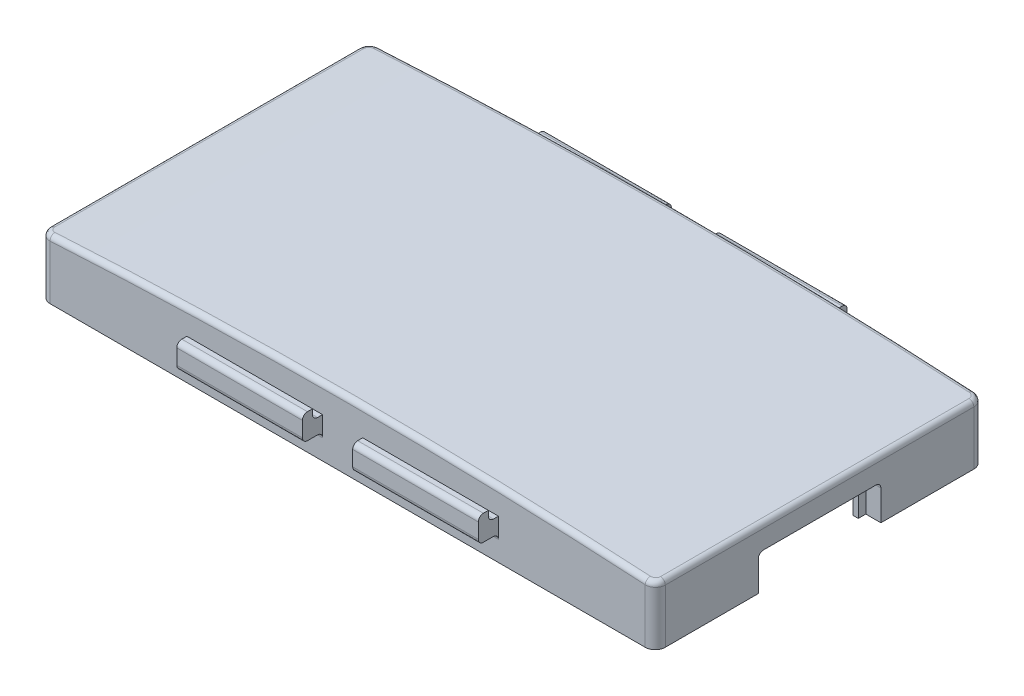
from build123d import *

# Parameters (mm, degrees)
BOSS_EXTRUDE4_DEPTH             = 0.5
BOSS_EXTRUDE5_REACH             = 36.87
BOSS_EXTRUDE5_DIRECTION_2_REACH = 36.87
BOSS_EXTRUDE6_REACH             = 37.345
BOSS_EXTRUDE6_END_RADIUS        = 508.215
SKETCH2_7_R                     = 1.125
FILLET3_R                       = 1
SKETCH6_W                       = 10.7
SKETCH6_H                       = 2.75
CUT_EXTRUDE2_DEPTH              = 2
SKETCH6_3_W                     = 10.7
SKETCH6_3_H                     = 4.25
SKETCH6_3_W_2                   = 12.2
SKETCH6_3_H_2                   = 3.5
CUT_EXTRUDE3_DEPTH              = 1.5
BOSS_EXTRUDE7_START             = 0.5
BOSS_EXTRUDE7_DEPTH             = 4.75
FILLET5_R                       = 0.5
CUT_EXTRUDE5_DEPTH              = 2.5
RAIL_DEPTH                      = 15
CUT_EXTRUDE6_DEPTH              = 2.5
FILLET7_R                       = 0.5
FILLET7_OF_MIRROR1_R            = 0.5
FILLET8_R                       = 0.5
FILLET9_R                       = 0.5


with BuildPart() as part:
    # Sketch2 → Boss-Extrude4 (new body)
    with BuildSketch(Plane(origin=(0, 0, 0), x_dir=(1, 0, 0), z_dir=(0, 1, 0))):
        Polygon((-30.6, 16.35), (-30.6, -16.35), (30.6, -16.35), (30.6, -6.1), (29.1, -6.1), (29.1, -5.35), (28.6, -5.35), (28.6, -14.35), (-28.6, -14.35), (-28.6, 14.35), (28.6, 14.35), (28.6, 5.35), (30.6, 5.35), (30.6, 16.35), align=None)
    extrude(amount=BOSS_EXTRUDE4_DEPTH)

    # Boss-Extrude5: up to this face of the body (flat: up to its plane)
    boss_extrude5_end = Plane(part.part.faces().sort_by_distance((0, 0.25, 16.35))[0])
    # Sketch5 → Boss-Extrude5 (add, up to the picked face)
    with BuildSketch(Plane(origin=(0, -3, 0), x_dir=(1, 0, 0), z_dir=(0, 0, 1)), mode=Mode.PRIVATE) as boss_extrude5_sk1:
        with BuildLine():
            Line((-28.6, 3.5), (-28.6, 6.5))
            ThreePointArc((-28.6, 6.5), (-28.307107, 7.207107), (-27.6, 7.5))
            ThreePointArc((-27.6, 7.5), (0, 8.25), (27.6, 7.5))
            ThreePointArc((27.6, 7.5), (28.307107, 7.207107), (28.6, 6.5))
            Line((28.6, 6.5), (28.6, 3.5))
            Line((28.6, 3.5), (30.6, 3.5))
            Line((30.6, 3.5), (30.6, 8.830658))
            ThreePointArc((30.6, 8.830658), (0, 9.75), (-30.6, 8.830658))
            Line((-30.6, 8.830658), (-30.6, 3.5))
            Line((-30.6, 3.5), (-28.6, 3.5))
        make_face()
    boss_extrude5_tool1 = split(extrude(boss_extrude5_sk1.sketch, amount=BOSS_EXTRUDE5_REACH, mode=Mode.PRIVATE), bisect_by=boss_extrude5_end, keep=Keep.BOTH, mode=Mode.PRIVATE)
    add(boss_extrude5_tool1.solids().sort_by(Axis((-29.984817, 3.165329, 0), (0, 0, 1)))[0])

    # Boss-Extrude5 direction 2: up to this face of the body (flat: up to its plane)
    boss_extrude5_direction_2_end = Plane(part.part.faces().sort_by_distance((0, 0.25, -16.35))[0])
    # Sketch5 → Boss-Extrude5 direction 2 (add, up to the picked face)
    with BuildSketch(Plane(origin=(0, -3, 0), x_dir=(1, 0, 0), z_dir=(0, 0, 1)), mode=Mode.PRIVATE) as boss_extrude5_direction_2_sk1:
        with BuildLine():
            Line((-28.6, 3.5), (-28.6, 6.5))
            ThreePointArc((-28.6, 6.5), (-28.307107, 7.207107), (-27.6, 7.5))
            ThreePointArc((-27.6, 7.5), (0, 8.25), (27.6, 7.5))
            ThreePointArc((27.6, 7.5), (28.307107, 7.207107), (28.6, 6.5))
            Line((28.6, 6.5), (28.6, 3.5))
            Line((28.6, 3.5), (30.6, 3.5))
            Line((30.6, 3.5), (30.6, 8.830658))
            ThreePointArc((30.6, 8.830658), (0, 9.75), (-30.6, 8.830658))
            Line((-30.6, 8.830658), (-30.6, 3.5))
            Line((-30.6, 3.5), (-28.6, 3.5))
        make_face()
    boss_extrude5_direction_2_tool1 = split(extrude(boss_extrude5_direction_2_sk1.sketch, amount=-BOSS_EXTRUDE5_DIRECTION_2_REACH, mode=Mode.PRIVATE), bisect_by=boss_extrude5_direction_2_end, keep=Keep.BOTH, mode=Mode.PRIVATE)
    add(boss_extrude5_direction_2_tool1.solids().sort_by(Axis((-29.984817, 3.165329, 0), (0, 0, -1)))[0])

    # Boss-Extrude6: up to this cylinder (the profile starts inside it)
    boss_extrude6_end = Plane(origin=(0, -502.965, 0), z_dir=(0, 0, -1)) * Cylinder(BOSS_EXTRUDE6_END_RADIUS, 1115.62, mode=Mode.PRIVATE)
    # Sketch2<7> → Boss-Extrude6 (add, up to the surface)
    with BuildSketch(Plane(origin=(0, 0, 0), x_dir=(1, 0, 0), z_dir=(0, 1, 0)), mode=Mode.PRIVATE) as boss_extrude6_sk1:
        with Locations(Location((26, 11.75, 0), (0, 0, 90))):
            Circle(SKETCH2_7_R)
    boss_extrude6_tool1 = extrude(boss_extrude6_sk1.sketch, amount=BOSS_EXTRUDE6_REACH, mode=Mode.PRIVATE) & boss_extrude6_end
    add(boss_extrude6_tool1.solids().sort_by_distance((26, 0, -11.75))[0])
    # Sketch2<7> → Boss-Extrude6 (add, up to the surface)
    with BuildSketch(Plane(origin=(0, 0, 0), x_dir=(1, 0, 0), z_dir=(0, 1, 0)), mode=Mode.PRIVATE) as boss_extrude6_sk2:
        with Locations(Location((26, -11.75, 0), (0, 0, 90))):
            Circle(SKETCH2_7_R)
    boss_extrude6_tool2 = extrude(boss_extrude6_sk2.sketch, amount=BOSS_EXTRUDE6_REACH, mode=Mode.PRIVATE) & boss_extrude6_end
    add(boss_extrude6_tool2.solids().sort_by_distance((26, 0, 11.75))[0])
    # Sketch2<7> → Boss-Extrude6 (add, up to the surface)
    with BuildSketch(Plane(origin=(0, 0, 0), x_dir=(1, 0, 0), z_dir=(0, 1, 0)), mode=Mode.PRIVATE) as boss_extrude6_sk3:
        with Locations(Location((-26, 11.75, 0), (0, 0, 90))):
            Circle(SKETCH2_7_R)
    boss_extrude6_tool3 = extrude(boss_extrude6_sk3.sketch, amount=BOSS_EXTRUDE6_REACH, mode=Mode.PRIVATE) & boss_extrude6_end
    add(boss_extrude6_tool3.solids().sort_by_distance((-26, 0, -11.75))[0])
    # Sketch2<7> → Boss-Extrude6 (add, up to the surface)
    with BuildSketch(Plane(origin=(0, 0, 0), x_dir=(1, 0, 0), z_dir=(0, 1, 0)), mode=Mode.PRIVATE) as boss_extrude6_sk4:
        with Locations(Location((-26, -11.75, 0), (0, 0, 90))):
            Circle(SKETCH2_7_R)
    boss_extrude6_tool4 = extrude(boss_extrude6_sk4.sketch, amount=BOSS_EXTRUDE6_REACH, mode=Mode.PRIVATE) & boss_extrude6_end
    add(boss_extrude6_tool4.solids().sort_by_distance((-26, 0, 11.75))[0])

    # Fillet3
    fillet3_edges = [part.edges().sort_by_distance(p)[0] for p in [
        (30.6, 2.915329, 16.35),
        (-30.6, 2.915329, 16.35),
        (-30.6, 2.915329, -16.35),
        (30.6, 2.915329, -16.35),
    ]]
    fillet(fillet3_edges, radius=FILLET3_R)

    # Sketch6 → Cut-Extrude2 (cut)
    with BuildSketch(Plane(origin=(30.6, 0, 0), x_dir=(0, 0, -1), z_dir=(1, 0, 0))):
        with Locations((0, 1.375)):
            Rectangle(SKETCH6_W, SKETCH6_H)
    extrude(amount=-CUT_EXTRUDE2_DEPTH, mode=Mode.SUBTRACT)

    # Sketch6<3> → Cut-Extrude3 (cut)
    with BuildSketch(Plane(origin=(30.6, 0, 0), x_dir=(0, 0, -1), z_dir=(1, 0, 0))):
        with Locations((0, 0.625)):
            Rectangle(SKETCH6_3_W, SKETCH6_3_H)
        with Locations((0, 1.75)):
            Rectangle(SKETCH6_3_W_2, SKETCH6_3_H_2)
    extrude(amount=-CUT_EXTRUDE3_DEPTH, mode=Mode.SUBTRACT)

    # Sketch2<8> → Boss-Extrude7 (add)
    with BuildSketch(Plane(origin=(0, 0, 0), x_dir=(1, 0, 0), z_dir=(0, 1, 0)).offset(BOSS_EXTRUDE7_START)):
        with BuildLine():
            Line((-30.6, 15.35), (-30.6, -15.35))
            ThreePointArc((-30.6, -15.35), (-30.307107, -16.057107), (-29.6, -16.35))
            Line((-29.6, -16.35), (29.6, -16.35))
            ThreePointArc((29.6, -16.35), (30.307107, -16.057107), (30.6, -15.35))
            Line((30.6, -15.35), (30.6, -6.1))
            Line((30.6, -6.1), (29.1, -6.1))
            Line((29.1, -6.1), (29.1, -5.35))
            Line((29.1, -5.35), (28.6, -5.35))
            Line((28.6, -5.35), (28.6, -14.35))
            Line((28.6, -14.35), (-28.6, -14.35))
            Line((-28.6, -14.35), (-28.6, 14.35))
            Line((-28.6, 14.35), (28.6, 14.35))
            Line((28.6, 14.35), (28.6, 5.35))
            Line((28.6, 5.35), (29.1, 5.35))
            Line((29.1, 5.35), (29.1, 6.1))
            Line((29.1, 6.1), (30.6, 6.1))
            Line((30.6, 6.1), (30.6, 15.35))
            ThreePointArc((30.6, 15.35), (30.307107, 16.057107), (29.6, 16.35))
            Line((29.6, 16.35), (-29.6, 16.35))
            ThreePointArc((-29.6, 16.35), (-30.307107, 16.057107), (-30.6, 15.35))
        make_face()
    extrude(amount=BOSS_EXTRUDE7_DEPTH)

    # Fillet5
    fillet5_edges = [part.edges().sort_by_distance(p)[0] for p in [
        (28.85, 2.75, -5.35),
        (28.85, 2.75, 5.35),
        (29.85, 3.5, 6.1),
        (29.85, 3.5, -6.1),
    ]]
    fillet(fillet5_edges, radius=FILLET5_R)

    # Sketch12 → Cut-Extrude5 (cut)
    with BuildSketch(Plane(origin=(0, 0, 0), x_dir=(1, 0, 0), z_dir=(0, 1, 0))):
        Polygon((-29.6, 15.35), (-29.6, -15.35), (29.6, -15.35), (29.6, -7.6), (28.6, -7.6), (28.6, -14.35), (-28.6, -14.35), (-28.6, 14.35), (28.6, 14.35), (28.6, 7.6), (29.6, 7.6), (29.6, 15.35), align=None)
    extrude(amount=CUT_EXTRUDE5_DEPTH, mode=Mode.SUBTRACT)

    # Sketch13 → rail (add, symmetric)
    with BuildSketch(Plane(origin=(0, 0, 0), x_dir=(0, 0, -1), z_dir=(1, 0, 0))):
        Polygon((-16.35, 2.5), (-18.35, 2.5), (-18.35, 5), (-17.35, 5), (-17.35, 4), (-16.35, 4), align=None)
    rail = extrude(amount=RAIL_DEPTH, both=True)

    # Sketch13<3> → Cut-Extrude6 (cut, symmetric)
    with BuildSketch(Plane(origin=(0, 0, 0), x_dir=(0, 0, -1), z_dir=(1, 0, 0))):
        Polygon((-16.35, 2.5), (-18.35, 2.5), (-18.35, 5), (-17.35, 5), (-17.35, 4), (-16.35, 4), align=None)
    cut_extrude6 = extrude(amount=CUT_EXTRUDE6_DEPTH, both=True, mode=Mode.SUBTRACT)

    # Fillet7
    fillet7_edges = [part.edges().sort_by_distance(p)[0] for p in [
        (8.75, 4, 17.35),
        (8.75, 5, 18.35),
        (8.75, 2.5, 18.35),
        (-8.75, 2.5, 18.35),
        (-8.75, 5, 18.35),
        (-8.75, 4, 17.35),
    ]]
    fillet(fillet7_edges, radius=FILLET7_R)

    # Mirror1: rail, Cut-Extrude6 across plane
    add(rail.mirror(Plane.XY))
    add(cut_extrude6.mirror(Plane.XY), mode=Mode.SUBTRACT)

    # Fillet7 of Mirror1
    fillet7_of_mirror1_edges = [part.edges().sort_by_distance(p)[0] for p in [
        (8.75, 4, -17.35),
        (8.75, 5, -18.35),
        (8.75, 2.5, -18.35),
        (-8.75, 2.5, -18.35),
        (-8.75, 5, -18.35),
        (-8.75, 4, -17.35),
    ]]
    fillet(fillet7_of_mirror1_edges, radius=FILLET7_OF_MIRROR1_R)

    # Fillet8
    fillet8_edges = [part.edges().sort_by_distance(p)[0] for p in [
        (8.75, 2.5, 16.35),
        (-8.75, 2.5, 16.35),
        (8.75, 2.5, -16.35),
        (-8.75, 2.5, -16.35),
    ]]
    fillet(fillet8_edges, radius=FILLET8_R)

    # Fillet9
    fillet9_edges = [part.edges().sort_by_distance(p)[0] for p in [
        (0, 6.75, 16.35),
        (-30.6, 5.830658, 0),
        (30.6, 5.830658, 0),
        (0, 6.75, -16.35),
        (30.306804, 5.848206, 16.057409),
        (30.306804, 5.848206, -16.057409),
        (-30.306804, 5.848206, -16.057409),
        (-30.306804, 5.848206, 16.057409),
    ]]
    fillet(fillet9_edges, radius=FILLET9_R)


solid = part.part
